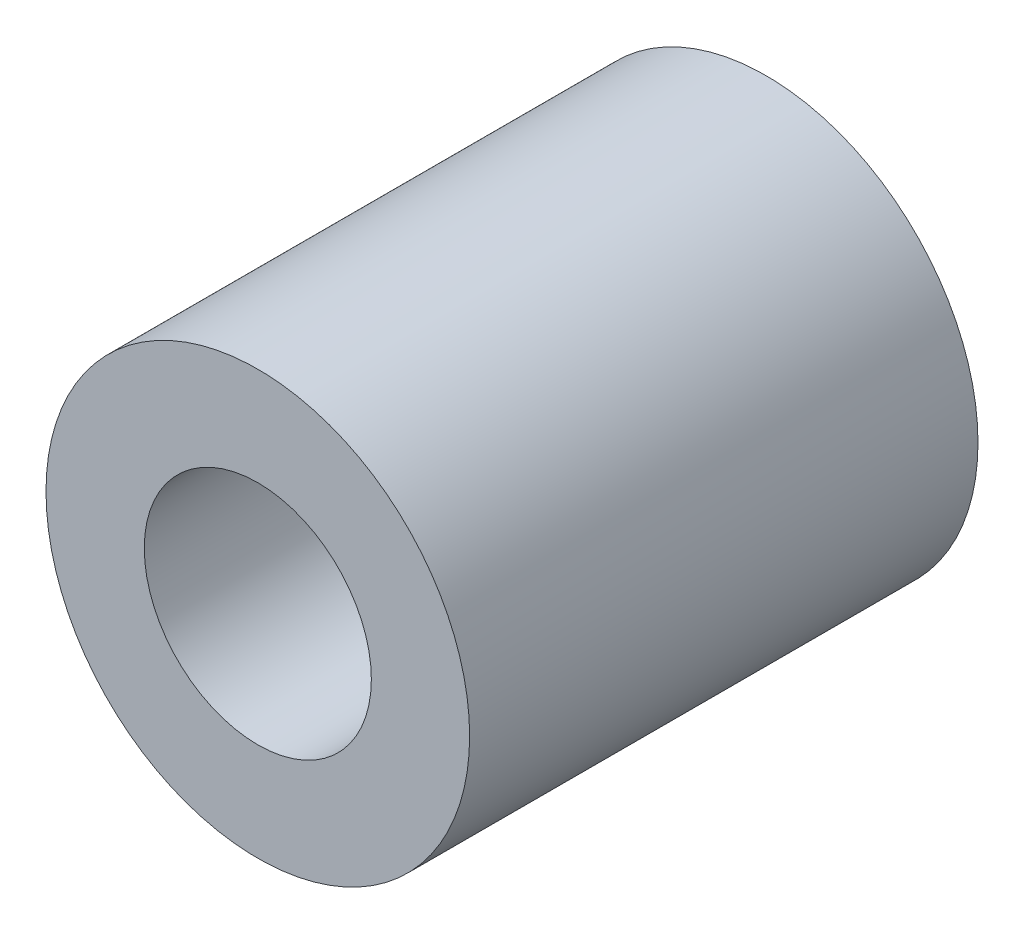
from build123d import *

# Parameters (mm, degrees)
SKETCH1_R           = 4.7625
SKETCH1_R_2         = 2.5527
BOSS_EXTRUDE1_DEPTH = 11.43


with BuildPart() as part:
    # Sketch1 → Boss-Extrude1 (new body)
    with BuildSketch(Plane.XY):
        Circle(SKETCH1_R)
        Circle(SKETCH1_R_2, mode=Mode.SUBTRACT)
    extrude(amount=BOSS_EXTRUDE1_DEPTH)


solid = part.part
